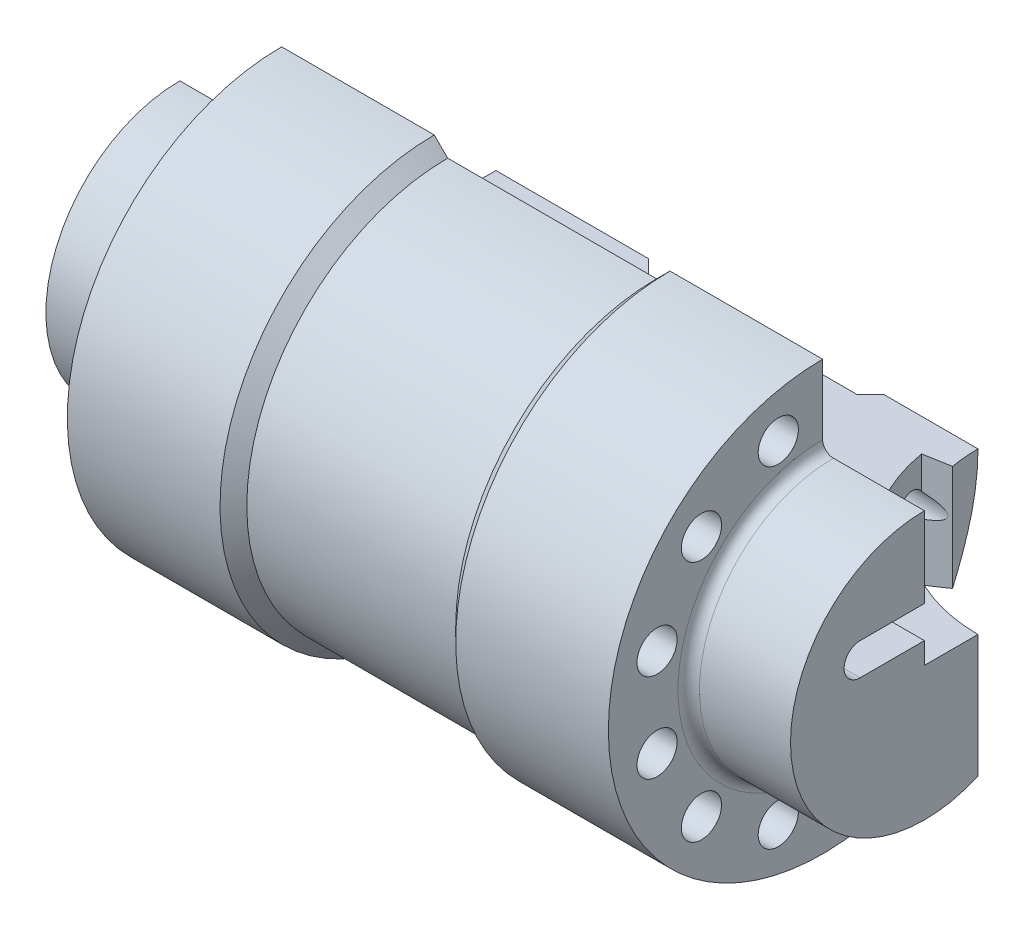
from build123d import *

# Parameters (mm, degrees)
REVOLVE1_ANGLE     = 270
CUT_EXTRUDE1_DEPTH = 151.069983674
SKETCH3_R          = 3.75
CUT_EXTRUDE2_DEPTH = 133.664991614
SKETCH5_R          = 30
CUT_EXTRUDE3_DEPTH = 151.069983674
CUT_EXTRUDE4_DEPTH = 151.06998382


with BuildPart() as part:
    # Sketch1 → Revolve1 (revolve)
    with BuildSketch(Plane.XY):
        with BuildLine():
            Line((47.5, 40), (50, 37.5))
            Line((50, 37.5), (89, 37.5))
            Line((89, 37.5), (91.5, 40))
            Line((91.5, 40), (120, 40))
            Line((120, 40), (120, 27))
            ThreePointArc((120, 27), (120.585786438, 25.585786438), (122, 25))
            Line((122, 25), (139, 25))
            Line((139, 25), (139, 0))
            Line((139, 0), (0, 0))
            Line((0, 0), (0, 25))
            Line((0, 25), (17, 25))
            ThreePointArc((17, 25), (18.414213562, 25.585786438), (19, 27))
            Line((19, 27), (19, 40))
            Line((19, 40), (47.5, 40))
        make_face()
    revolve(axis=Axis((0, 0, 0), (1, 0, 0)), revolution_arc=REVOLVE1_ANGLE)

    # Sketch2 → Cut-Extrude1 (cut, through all)
    with BuildSketch(Plane.ZY):
        with BuildLine():
            Line((0, 10), (12, 10))
            ThreePointArc((12, 10), (15, 7), (12, 4))
            Line((12, 4), (0, 4))
            ThreePointArc((0, 4), (-3, 7), (0, 10))
        make_face()
    extrude(amount=-CUT_EXTRUDE1_DEPTH, mode=Mode.SUBTRACT)

    # Sketch3 → Cut-Extrude2 (cut, through all)
    with BuildSketch(Plane(origin=(120, 0, 0), x_dir=(0, 0, -1), z_dir=(1, 0, 0))):
        with Locations((-8.282209443, 30.909626441)):
            Circle(SKETCH3_R)
        with Locations((30.909626441, -8.282209443)):
            Circle(SKETCH3_R)
        with Locations((22.627416998, -22.627416998)):
            Circle(SKETCH3_R)
        with Locations((8.282209443, -30.909626441)):
            Circle(SKETCH3_R)
        with Locations((-8.282209443, -30.909626441)):
            Circle(SKETCH3_R)
        with Locations((-22.627416998, -22.627416998)):
            Circle(SKETCH3_R)
        with Locations((-30.909626441, -8.282209443)):
            Circle(SKETCH3_R)
        with Locations((-30.909626441, 8.282209443)):
            Circle(SKETCH3_R)
        with Locations((-22.627416998, 22.627416998)):
            Circle(SKETCH3_R)
    extrude(amount=-CUT_EXTRUDE2_DEPTH, mode=Mode.SUBTRACT)

    # Sketch5 → Cut-Extrude3 (cut, through all)
    with BuildSketch(Plane(origin=(0, 0, 0), x_dir=(1, 0, 0), z_dir=(0, 1, 0))):
        with Locations((139, 40)):
            Circle(SKETCH5_R)
    extrude(amount=-CUT_EXTRUDE3_DEPTH, mode=Mode.SUBTRACT)

    # Sketch6 → Cut-Extrude4 (cut, through all)
    with BuildSketch(Plane(origin=(0, 0, 0), x_dir=(1, 0, 0), z_dir=(0, 1, 0))):
        with BuildLine():
            Line((104.531728645, 33.922313782), (109.45576741, 34.79055467))
            ThreePointArc((109.45576741, 34.79055467), (115.199399791, 21.73715713), (126.321452148, 12.810766389))
            Line((126.321452148, 12.810766389), (124.208360839, 8.279227454))
            ThreePointArc((124.208360839, 8.279227454), (111.23263309, 18.693349985), (104.531728645, 33.922313782))
        make_face()
    extrude(amount=-CUT_EXTRUDE4_DEPTH, mode=Mode.SUBTRACT)


solid = part.part
